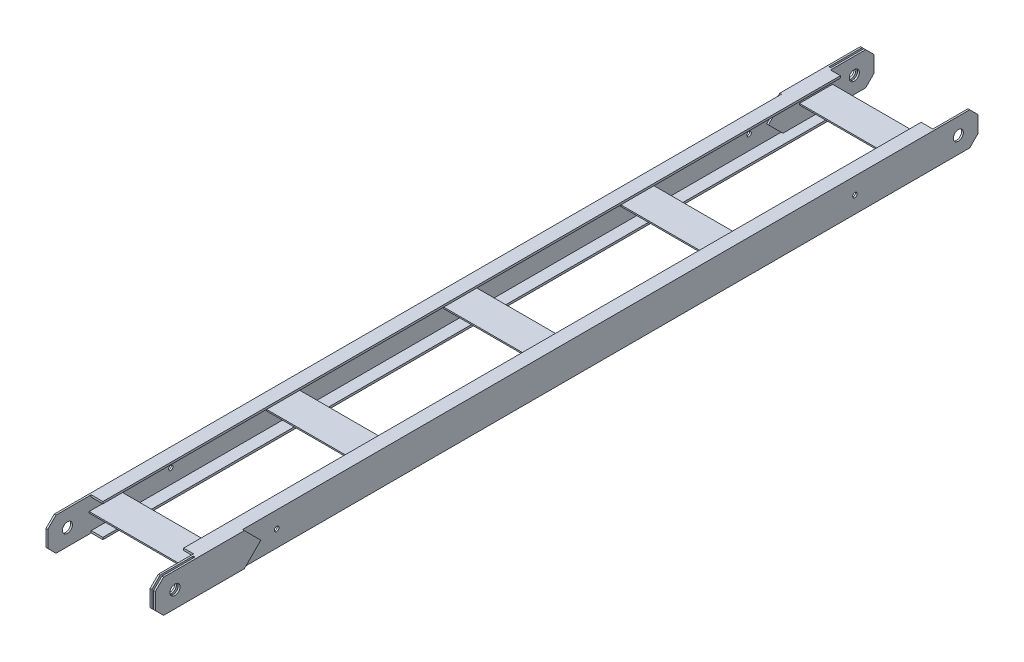
from build123d import *

# Parameters (mm, degrees)
EXTRUDE_1_DEPTH        = 3985
EXTRUDE_1_2_DEPTH      = 3985
EXTRUDE_3_DEPTH        = 520
SKETCH_6_W             = 503
SKETCH_6_H             = 200
CUT_EXTRUDE_4_DEPTH    = 4022.96780196
PATTERN_LINEAR_1_COUNT = 5
PATTERN_LINEAR_1_PITCH = 856.25
EXTRUDE_11_DEPTH       = 8.5
PATTERN_LINEAR_2_COUNT = 2
PATTERN_LINEAR_2_PITCH = 17
SKETCH_22_W            = 8.5
SKETCH_22_H            = 200
CUT_EXTRUDE_12_DEPTH   = 4024.075595859
SKETCH_23_R            = 24.25
CUT_EXTRUDE_13_DEPTH   = 4024.075595859
EXTRUDE_14_DEPTH       = 8.5
PATTERN_LINEAR_3_COUNT = 2
PATTERN_LINEAR_3_PITCH = 17
SKETCH_27_W            = 8.5
SKETCH_27_H            = 200
CUT_EXTRUDE_15_DEPTH   = 4024.075595859
SKETCH_28_R            = 24.25
CUT_EXTRUDE_16_DEPTH   = 4025.201038716
SKETCH_29_W            = 494.5
SKETCH_29_H            = 10
CUT_EXTRUDE_17_DEPTH   = 10
SKETCH_30_W            = 494.5
SKETCH_30_H            = 10
CUT_EXTRUDE_18_DEPTH   = 10
SKETCH_31_R            = 11
CUT_EXTRUDE_19_DEPTH   = 4024.075595859
CHAMFER_1_SIZE         = 40


with BuildPart() as part:
    # 草图2 → 拉伸1 (new body)
    with BuildSketch(Plane.XY):
        Polygon((0, 0), (0, 160), (65, 160), (65, 150), (8.5, 150), (8.5, 10), (65, 10), (65, 0), align=None)
    extrude(amount=EXTRUDE_1_DEPTH)



with BuildPart() as body_2:
    # 草图2 → Extrude 1 2 (new body)
    with BuildSketch(Plane.XY):
        Polygon((455, 160), (520, 160), (520, 0), (455, 0), (455, 10), (511.5, 10), (511.5, 150), (455, 150), align=None)
    extrude(amount=EXTRUDE_1_2_DEPTH)


with BuildPart() as part_1:
    add(part.part)

    add(body_2.part)  # 拉伸3 merges body 2
    # 草图5 → 拉伸3 (add)
    with BuildSketch(Plane.ZY):
        Polygon((200, 95), (360, 95), (360, 88.5), (283.25, 88.5), (283.25, 48.5), (276.75, 48.5), (276.75, 88.5), (200, 88.5), align=None)
    extrude_3 = extrude(amount=-EXTRUDE_3_DEPTH)

    # 草图6 → 拉伸4 (cut, through all)
    with BuildSketch(Plane(origin=(0, 160, 0), x_dir=(1, 0, 0), z_dir=(0, 1, 0))):
        with Locations((260, -100)):
            Rectangle(SKETCH_6_W, SKETCH_6_H)
        with Locations((260, -3885)):
            Rectangle(SKETCH_6_W, SKETCH_6_H)
    extrude(amount=-CUT_EXTRUDE_4_DEPTH, mode=Mode.SUBTRACT)

    # 阵列(线性)1: 拉伸3 ×5
    with Locations(*[(0, 0, i * PATTERN_LINEAR_1_PITCH) for i in range(1, PATTERN_LINEAR_1_COUNT)]):
        add(extrude_3)

    # 草图19 → 拉伸11 (add)
    with BuildSketch(Plane(origin=(520, 0, 0), x_dir=(0, 0, -1), z_dir=(1, 0, 0))):
        Polygon((-3985, 160), (-3555, 160), (-3475, 80), (-3555, 0), (-3985, 0), align=None)
    extrude_11 = extrude(amount=EXTRUDE_11_DEPTH)

    # 阵列(线性)2: 拉伸11 ×2
    with Locations(*[(-i * PATTERN_LINEAR_2_PITCH, 0, 0) for i in range(1, PATTERN_LINEAR_2_COUNT)]):
        add(extrude_11)

    # 草图22 → 拉伸12 (cut, through all)
    with BuildSketch(Plane(origin=(0, 160, 0), x_dir=(1, 0, 0), z_dir=(0, 1, 0))):
        with Locations((515.75, -3885)):
            Rectangle(SKETCH_22_W, SKETCH_22_H)
    extrude(amount=-CUT_EXTRUDE_12_DEPTH, mode=Mode.SUBTRACT)

    # 草图23 → 拉伸13 (cut, through all)
    with BuildSketch(Plane.ZY):
        with Locations(Location((95, 80, 0), (0, 0, 180))):
            Circle(SKETCH_23_R)
        with Locations(Location((3890, 80, 0), (0, 0, 180))):
            Circle(SKETCH_23_R)
    extrude(amount=-CUT_EXTRUDE_13_DEPTH, mode=Mode.SUBTRACT)

    # 草图26 → 拉伸14 (add)
    with BuildSketch(Plane.ZY):
        Polygon((0, 160), (0, 0), (430, 0), (510, 80), (430, 160), align=None)
    extrude_14 = extrude(amount=EXTRUDE_14_DEPTH)

    # 阵列(线性)3: 拉伸14 ×2
    with Locations(*[(i * PATTERN_LINEAR_3_PITCH, 0, 0) for i in range(1, PATTERN_LINEAR_3_COUNT)]):
        add(extrude_14)

    # 草图27 → 拉伸15 (cut, through all)
    with BuildSketch(Plane(origin=(0, 160, 0), x_dir=(1, 0, 0), z_dir=(0, 1, 0))):
        with Locations((4.25, -100)):
            Rectangle(SKETCH_27_W, SKETCH_27_H)
    extrude(amount=-CUT_EXTRUDE_15_DEPTH, mode=Mode.SUBTRACT)

    # 草图28 → 拉伸16 (cut, through all)
    with BuildSketch(Plane.ZY.offset(8.5)):
        with Locations(Location((95, 80, 0), (0, 0, 180))):
            Circle(SKETCH_28_R)
    extrude(amount=-CUT_EXTRUDE_16_DEPTH, mode=Mode.SUBTRACT)

    # 草图29 → 拉伸17 (cut)
    with BuildSketch(Plane.XY.offset(3785)):
        with Locations((255.75, 155)):
            Rectangle(SKETCH_29_W, SKETCH_29_H)
        with Locations((255.75, 5)):
            Rectangle(SKETCH_29_W, SKETCH_29_H)
    extrude(amount=-CUT_EXTRUDE_17_DEPTH, mode=Mode.SUBTRACT)

    # 草图30 → 拉伸18 (cut)
    with BuildSketch(Plane(origin=(0, 0, 200), x_dir=(-1, 0, 0), z_dir=(0, 0, -1))):
        with Locations((-264.25, 155)):
            Rectangle(SKETCH_30_W, SKETCH_30_H)
        with Locations((-264.25, 5)):
            Rectangle(SKETCH_30_W, SKETCH_30_H)
    extrude(amount=-CUT_EXTRUDE_18_DEPTH, mode=Mode.SUBTRACT)

    # 草图31 → 拉伸19 (cut, through all)
    with BuildSketch(Plane(origin=(520, 0, 0), x_dir=(0, 0, -1), z_dir=(1, 0, 0))):
        with Locations((-595, 80)):
            Circle(SKETCH_31_R)
        with Locations((-3390, 80)):
            Circle(SKETCH_31_R)
    extrude(amount=-CUT_EXTRUDE_19_DEPTH, mode=Mode.SUBTRACT)

    # 倒角1
    chamfer_1_edges = [part_1.edges().sort_by_distance(p)[0] for p in [
        (-4.25, 0, 0),
        (507.25, 0, 3985),
        (4.25, 160, 3985),
        (4.25, 0, 3985),
        (507.25, 160, 3985),
        (524.25, 0, 3985),
        (-4.25, 160, 0),
        (12.75, 0, 0),
        (515.75, 160, 0),
        (524.25, 160, 3985),
        (515.75, 0, 0),
        (12.75, 160, 0),
    ]]
    chamfer(chamfer_1_edges, length=CHAMFER_1_SIZE)


solid = part_1.part
